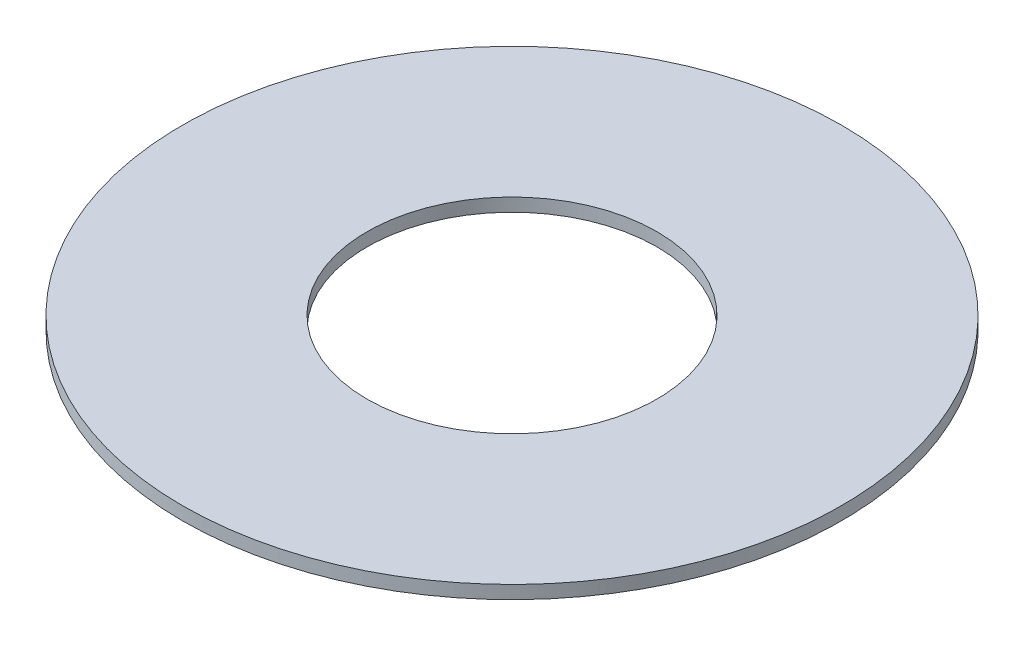
from build123d import *

# Parameters (mm, degrees)
ESQUISSE1_R        = 125
ESQUISSE1_R_2      = 55
BOSS_EXTRU_1_DEPTH = 5


with BuildPart() as part:
    # Esquisse1 → Boss.-Extru.1 (new body)
    with BuildSketch(Plane(origin=(0, 0, 0), x_dir=(1, 0, 0), z_dir=(0, 1, 0))):
        with Locations(Location((0, 0, 0), (0, 0, 270))):
            Circle(ESQUISSE1_R)
        with Locations(Location((0, 0, 0), (0, 0, 270))):
            Circle(ESQUISSE1_R_2, mode=Mode.SUBTRACT)
    extrude(amount=BOSS_EXTRU_1_DEPTH)


solid = part.part
